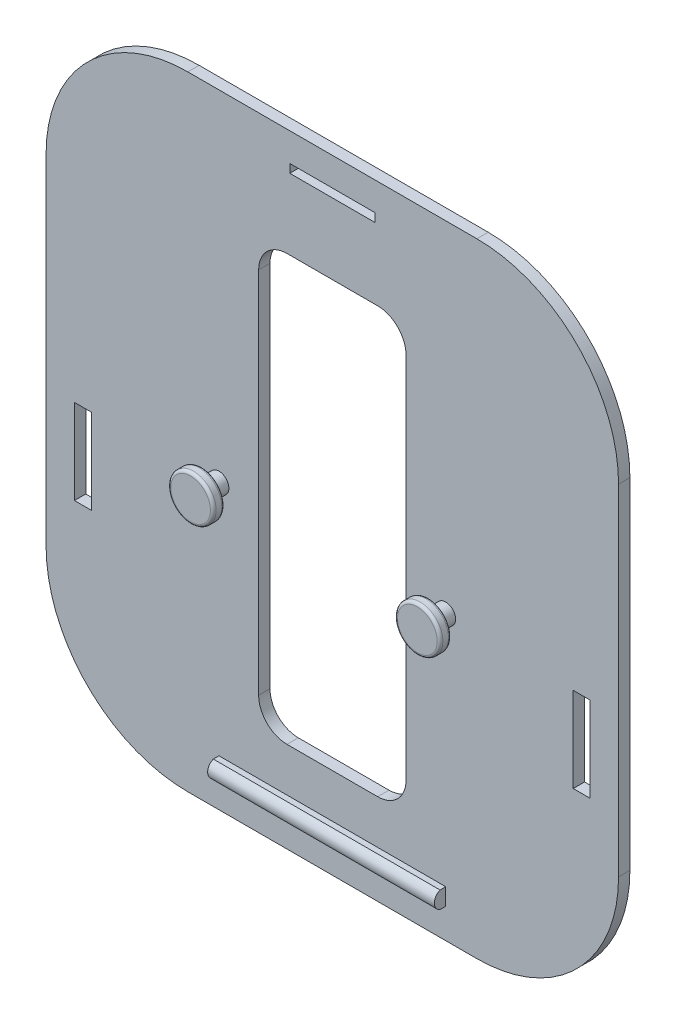
from build123d import *

# Parameters (mm, degrees)
SKETCH1_W           = 101
SKETCH1_H           = 110
BOSS_EXTRUDE1_DEPTH = 2
SKETCH3_W           = 15
SKETCH3_H           = 1.5
SKETCH3_W_2         = 3
SKETCH3_H_2         = 15
CUT_EXTRUDE1_DEPTH  = 128.433943673
SKETCH4_R           = 1.75
BOSS_EXTRUDE2_DEPTH = 5
SKETCH5_R           = 4
BOSS_EXTRUDE3_DEPTH = 2
FILLET1_R           = 0.5
FILLET2_R           = 25
SKETCH6_W           = 40
SKETCH6_H           = 3
BOSS_EXTRUDE4_DEPTH = 1
BOSS_EXTRUDE5_DEPTH = 40
SKETCH9_W           = 26
SKETCH9_H           = 75
CUT_EXTRUDE2_DEPTH  = 128.516312682
FILLET3_R           = 5


with BuildPart() as part:
    # Sketch1 → Boss-Extrude1 (new body)
    with BuildSketch(Plane.XY):
        with Locations((42.5, 32.1)):
            Rectangle(SKETCH1_W, SKETCH1_H)
    extrude(amount=BOSS_EXTRUDE1_DEPTH)

    # Sketch3 → Cut-Extrude1 (cut, through all)
    with BuildSketch(Plane.XY.offset(2)):
        with Locations((42.5, 81.35)):
            Rectangle(SKETCH3_W, SKETCH3_H)
        with Locations((-1.5, 19.1)):
            Rectangle(SKETCH3_W_2, SKETCH3_H_2)
        with Locations((86.5, 19.1)):
            Rectangle(SKETCH3_W_2, SKETCH3_H_2)
    extrude(amount=-CUT_EXTRUDE1_DEPTH, mode=Mode.SUBTRACT)

    # Sketch4 → Boss-Extrude2 (add)
    with BuildSketch(Plane.XY.offset(2)):
        with Locations((22.5, 27.1)):
            Circle(SKETCH4_R)
        with Locations((62.5, 27.1)):
            Circle(SKETCH4_R)
    extrude(amount=BOSS_EXTRUDE2_DEPTH)

    # Sketch5 → Boss-Extrude3 (add)
    with BuildSketch(Plane.XY.offset(7)):
        with Locations((22.5, 27.1)):
            Circle(SKETCH5_R)
        with Locations((62.5, 27.1)):
            Circle(SKETCH5_R)
    extrude(amount=-BOSS_EXTRUDE3_DEPTH)

    # Fillet1
    fillet1_edges = [part.edges().sort_by_distance(p)[0] for p in [
        (18.5, 27.1, 5),
        (18.5, 27.1, 7),
        (58.5, 27.1, 5),
        (58.5, 27.1, 7),
    ]]
    fillet(fillet1_edges, radius=FILLET1_R)

    # Fillet2
    fillet2_edges = [part.edges().sort_by_distance(p)[0] for p in [
        (-8, 87.1, 1),
        (93, 87.1, 1),
        (93, -22.9, 1),
        (-8, -22.9, 1),
    ]]
    fillet(fillet2_edges, radius=FILLET2_R)

    # Sketch6 → Boss-Extrude4 (add)
    with BuildSketch(Plane.XY.offset(2)):
        with Locations((42.5, -16.15)):
            Rectangle(SKETCH6_W, SKETCH6_H)
    extrude(amount=BOSS_EXTRUDE4_DEPTH)

    # Sketch7 → Boss-Extrude5 (add)
    with BuildSketch(Plane(origin=(62.5, 0, 0), x_dir=(0, 0, -1), z_dir=(1, 0, 0))):
        with BuildLine():
            Line((-3, -14.65), (-3, -17.65))
            ThreePointArc((-3, -17.65), (-4, -16.15), (-3, -14.65))
        make_face()
    extrude(amount=-BOSS_EXTRUDE5_DEPTH)

    # Sketch9 → Cut-Extrude2 (cut, through all)
    with BuildSketch(Plane.XY.offset(2)):
        with Locations((42.5, 30.6)):
            Rectangle(SKETCH9_W, SKETCH9_H)
    extrude(amount=-CUT_EXTRUDE2_DEPTH, mode=Mode.SUBTRACT)

    # Fillet3
    fillet3_edges = [part.edges().sort_by_distance(p)[0] for p in [
        (29.5, -6.9, 1),
        (29.5, 68.1, 1),
        (55.5, 68.1, 1),
        (55.5, -6.9, 1),
    ]]
    fillet(fillet3_edges, radius=FILLET3_R)


solid = part.part
